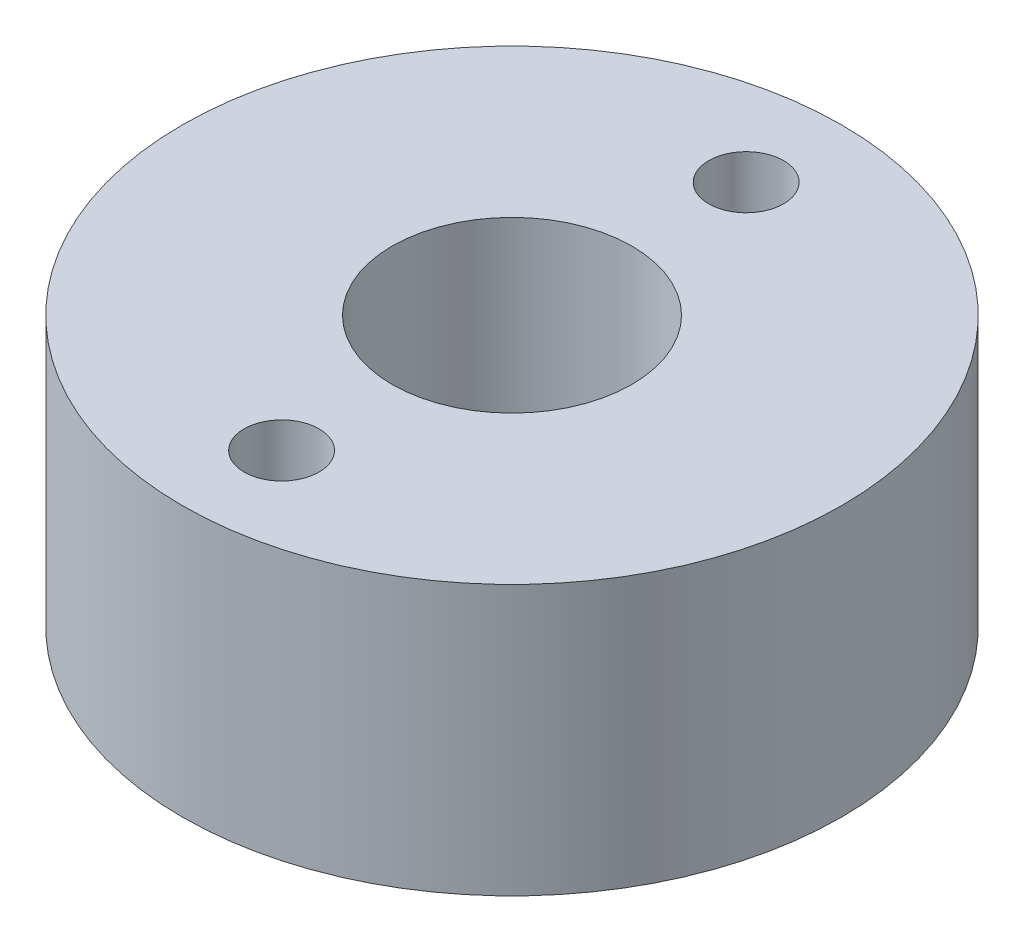
from build123d import *

# Parameters (mm, degrees)
SKETCH2_R           = 11
SKETCH2_R_2         = 4
BOSS_EXTRUDE2_DEPTH = 9
SKETCH3_R           = 1.25
CUT_EXTRUDE1_DEPTH  = 140.927642399


with BuildPart() as part:
    # Sketch2 → Boss-Extrude2 (new body)
    with BuildSketch(Plane(origin=(0, 0, 0), x_dir=(1, 0, 0), z_dir=(0, 1, 0))):
        with Locations(Location((-115.877600494, -47.316546538, 0), (0, 0, 270))):
            Circle(SKETCH2_R)
        with Locations(Location((-115.877600494, -47.316546538, 0), (0, 0, 270))):
            Circle(SKETCH2_R_2, mode=Mode.SUBTRACT)
    extrude(amount=BOSS_EXTRUDE2_DEPTH)

    # Sketch3 → Cut-Extrude1 (cut, through all)
    with BuildSketch(Plane(origin=(0, 9, 0), x_dir=(1, 0, 0), z_dir=(0, 1, 0))):
        with Locations(Location((-115.815100494, -39.566546538, 0), (0, 0, 270))):
            Circle(SKETCH3_R)
        with Locations(Location((-115.815100494, -55.066546538, 0), (0, 0, 90))):
            Circle(SKETCH3_R)
    extrude(amount=-CUT_EXTRUDE1_DEPTH, mode=Mode.SUBTRACT)


solid = part.part
